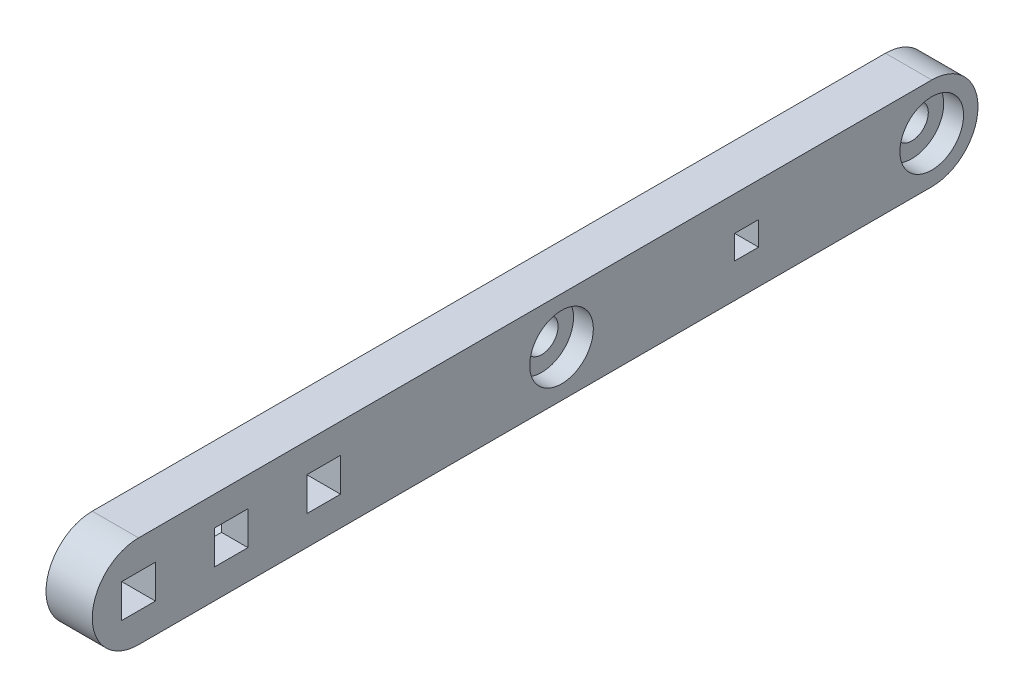
from build123d import *

# Parameters (mm, degrees)
SKETCH1_W                                      = 3.275
SKETCH1_H                                      = 3.275
SKETCH1_W_2                                    = 4.6228
SKETCH1_H_2                                    = 4.6228
BOSS_EXTRUDE1_DEPTH                            = 6.35
CBORE_FOR_8_BUTTON_HEAD_CAP_SCREW1_D           = 4.4958
CBORE_FOR_8_BUTTON_HEAD_CAP_SCREW1_CBORE_D     = 8.73252
CBORE_FOR_8_BUTTON_HEAD_CAP_SCREW1_CBORE_DEPTH = 2.7178
CBORE_FOR_8_BUTTON_HEAD_CAP_SCREW2_D           = 4.4958
CBORE_FOR_8_BUTTON_HEAD_CAP_SCREW2_CBORE_D     = 8.73252
CBORE_FOR_8_BUTTON_HEAD_CAP_SCREW2_CBORE_DEPTH = 2.7178


with BuildPart() as part:
    # Sketch1 → Boss-Extrude1 (new body)
    with BuildSketch(Plane(origin=(0, 0, 0), x_dir=(0, 0, -1), z_dir=(1, 0, 0))):
        with BuildLine():
            Line((-83.439, -6.35), (25.4, -6.35))
            ThreePointArc((25.4, -6.35), (31.75, 0), (25.4, 6.35))
            Line((25.4, 6.35), (-83.439, 6.35))
            ThreePointArc((-83.439, 6.35), (-89.789, 0), (-83.439, -6.35))
        make_face()
        Rectangle(SKETCH1_W, SKETCH1_H, mode=Mode.SUBTRACT)
        with Locations((-83.439, 0)):
            Rectangle(SKETCH1_W_2, SKETCH1_H_2, mode=Mode.SUBTRACT)
        with Locations((-58.039, 0)):
            Rectangle(SKETCH1_W_2, SKETCH1_H_2, mode=Mode.SUBTRACT)
        with Locations((-70.739, 0)):
            Rectangle(SKETCH1_W_2, SKETCH1_H_2, mode=Mode.SUBTRACT)
    extrude(amount=BOSS_EXTRUDE1_DEPTH)

    # CBORE for #8 Button Head Cap Screw1 (through all)
    with Locations(Plane(origin=(6.35, 0, 25.4), x_dir=(0, 0, 1), z_dir=(1, 0, 0))):
        with Locations((0, 0), (-50.8, 0)):
            CounterBoreHole(CBORE_FOR_8_BUTTON_HEAD_CAP_SCREW1_D / 2, CBORE_FOR_8_BUTTON_HEAD_CAP_SCREW1_CBORE_D / 2, CBORE_FOR_8_BUTTON_HEAD_CAP_SCREW1_CBORE_DEPTH)

    # CBORE for #8 Button Head Cap Screw2 (through all)
    with Locations(Plane(origin=(0, 0, 70.739), x_dir=(0, 0, -1), z_dir=(-1, 0, 0))):
        with Locations((0, 0)):
            CounterBoreHole(CBORE_FOR_8_BUTTON_HEAD_CAP_SCREW2_D / 2, CBORE_FOR_8_BUTTON_HEAD_CAP_SCREW2_CBORE_D / 2, CBORE_FOR_8_BUTTON_HEAD_CAP_SCREW2_CBORE_DEPTH)


solid = part.part
